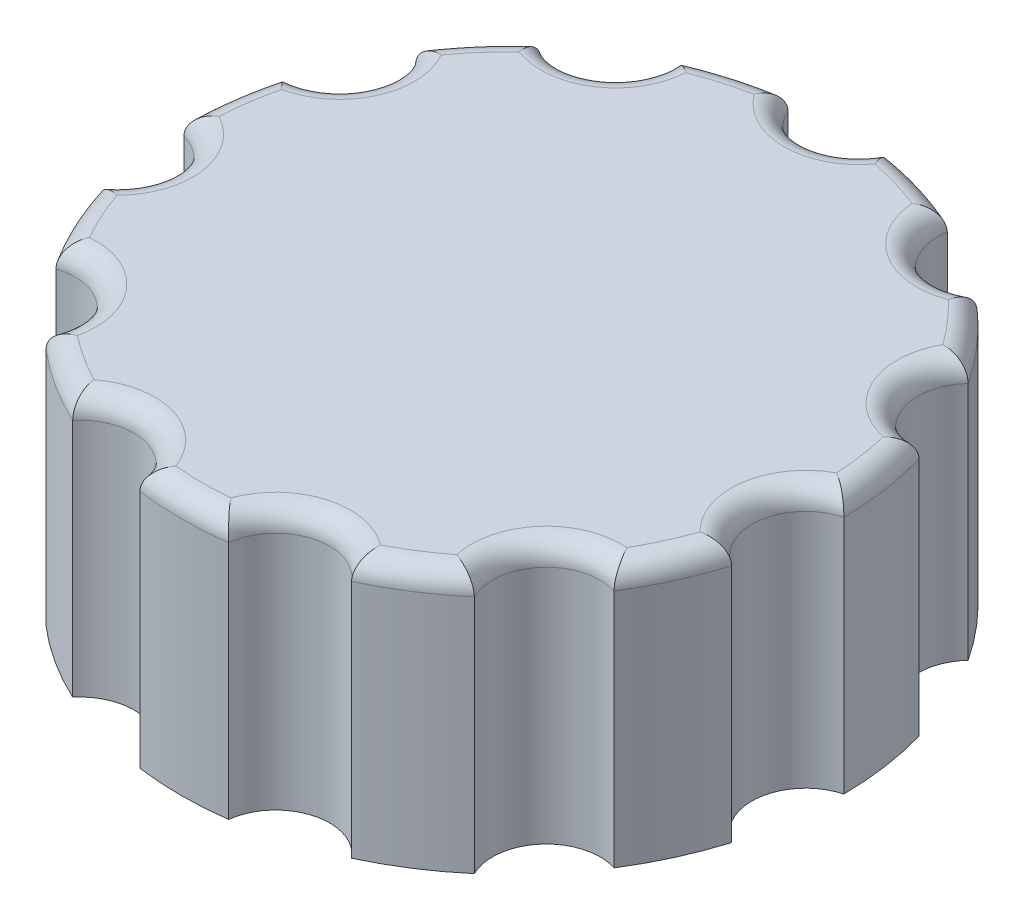
from build123d import *

# Parameters (mm, degrees)
SKETCH1_R           = 2.85
BOSS_EXTRUDE1_DEPTH = 6.5
BOSS_EXTRUDE2_START = 1
BOSS_EXTRUDE2_DEPTH = 1
FILLET1_R           = 0.6


with BuildPart() as part:
    # Sketch1 → Boss-Extrude1 (new body)
    with BuildSketch(Plane(origin=(0, 0, 0), x_dir=(1, 0, 0), z_dir=(0, 1, 0))):
        with BuildLine():
            ThreePointArc((9.093842395, -2.748095796), (8.363991184, -1.202560383), (9.499705936, 0.074747137))
            ThreePointArc((9.499705936, 0.074747137), (9.403303698, 1.351990964), (9.135959799, 2.604657089))
            ThreePointArc((9.135959799, 2.604657089), (7.686390361, 3.51025686), (7.951249826, 5.198810076))
            ThreePointArc((7.951249826, 5.198810076), (7.179620956, 6.221176972), (6.277474519, 7.130449752))
            ThreePointArc((6.277474519, 7.130449752), (4.568414907, 7.108592352), (3.878328077, 8.672287549))
            ThreePointArc((3.878328077, 8.672287549), (2.67645929, 9.115183249), (1.425935433, 9.392375))
            ThreePointArc((1.425935433, 9.392375), (0, 8.45), (-1.425935433, 9.392375))
            ThreePointArc((-1.425935433, 9.392375), (-2.67645929, 9.115183249), (-3.878328077, 8.672287549))
            ThreePointArc((-3.878328077, 8.672287549), (-3.861897872, 8.542873061), (-3.856408175, 8.412535328))
            ThreePointArc((-3.856408175, 8.412535328), (-4.68102994, 7.042744681), (-6.277474519, 7.130449752))
            ThreePointArc((-6.277474519, 7.130449752), (-7.179620956, 6.221176972), (-7.951249826, 5.198810076))
            ThreePointArc((-7.951249826, 5.198810076), (-7.651093553, 4.714347105), (-7.546319954, 4.15415013))
            ThreePointArc((-7.546319954, 4.15415013), (-8.014410013, 3.044208294), (-9.135959799, 2.604657089))
            ThreePointArc((-9.135959799, 2.604657089), (-9.403303698, 1.351990964), (-9.499705936, 0.074747137))
            ThreePointArc((-9.499705936, 0.074747137), (-8.669355568, -0.478475992), (-8.348214419, -1.423148383))
            ThreePointArc((-8.348214419, -1.423148383), (-8.547422681, -2.183320522), (-9.093842395, -2.748095796))
            ThreePointArc((-9.093842395, -2.748095796), (-8.641503956, -3.946442624), (-8.032072533, -5.073047489))
            ThreePointArc((-8.032072533, -5.073047489), (-6.644559279, -5.295991272), (-6.007495744, -6.548607339))
            ThreePointArc((-6.007495744, -6.548607339), (-6.047255322, -6.897425156), (-6.164494284, -7.228347683))
            ThreePointArc((-6.164494284, -7.228347683), (-5.136087766, -7.991908562), (-4.014312852, -8.610185383))
            ThreePointArc((-4.014312852, -8.610185383), (-2.380640105, -8.107715627), (-1.277962795, -9.413650254))
            ThreePointArc((-1.277962795, -9.413650254), (0, -9.5), (1.277962795, -9.413650254))
            ThreePointArc((1.277962795, -9.413650254), (2.380640105, -8.107715627), (4.014312852, -8.610185383))
            ThreePointArc((4.014312852, -8.610185383), (5.136087766, -7.991908562), (6.164494284, -7.228347683))
            ThreePointArc((6.164494284, -7.228347683), (6.386083903, -5.533573202), (8.032072533, -5.073047489))
            ThreePointArc((8.032072533, -5.073047489), (8.641503956, -3.946442624), (9.093842395, -2.748095796))
        make_face()
        Circle(SKETCH1_R, mode=Mode.SUBTRACT)
    extrude(amount=-BOSS_EXTRUDE1_DEPTH)

    # Sketch1<2> → Boss-Extrude2 (add)
    with BuildSketch(Plane(origin=(0, 0, 0), x_dir=(1, 0, 0), z_dir=(0, 1, 0)).offset(BOSS_EXTRUDE2_START)):
        with BuildLine():
            ThreePointArc((9.093842395, -2.748095796), (8.363991184, -1.202560383), (9.499705936, 0.074747137))
            ThreePointArc((9.499705936, 0.074747137), (9.403303698, 1.351990964), (9.135959799, 2.604657089))
            ThreePointArc((9.135959799, 2.604657089), (7.686390361, 3.51025686), (7.951249826, 5.198810076))
            ThreePointArc((7.951249826, 5.198810076), (7.179620956, 6.221176972), (6.277474519, 7.130449752))
            ThreePointArc((6.277474519, 7.130449752), (4.568414907, 7.108592352), (3.878328077, 8.672287549))
            ThreePointArc((3.878328077, 8.672287549), (2.67645929, 9.115183249), (1.425935433, 9.392375))
            ThreePointArc((1.425935433, 9.392375), (0, 8.45), (-1.425935433, 9.392375))
            ThreePointArc((-1.425935433, 9.392375), (-2.67645929, 9.115183249), (-3.878328077, 8.672287549))
            ThreePointArc((-3.878328077, 8.672287549), (-4.568414907, 7.108592352), (-6.277474519, 7.130449752))
            ThreePointArc((-6.277474519, 7.130449752), (-7.179620956, 6.221176972), (-7.951249826, 5.198810076))
            ThreePointArc((-7.951249826, 5.198810076), (-7.686390361, 3.51025686), (-9.135959799, 2.604657089))
            ThreePointArc((-9.135959799, 2.604657089), (-9.403303698, 1.351990964), (-9.499705936, 0.074747137))
            ThreePointArc((-9.499705936, 0.074747137), (-8.363991184, -1.202560383), (-9.093842395, -2.748095796))
            ThreePointArc((-9.093842395, -2.748095796), (-8.641503956, -3.946442624), (-8.032072533, -5.073047489))
            ThreePointArc((-8.032072533, -5.073047489), (-6.386083903, -5.533573202), (-6.164494284, -7.228347683))
            ThreePointArc((-6.164494284, -7.228347683), (-5.136087766, -7.991908562), (-4.014312852, -8.610185383))
            ThreePointArc((-4.014312852, -8.610185383), (-2.380640105, -8.107715627), (-1.277962795, -9.413650254))
            ThreePointArc((-1.277962795, -9.413650254), (0, -9.5), (1.277962795, -9.413650254))
            ThreePointArc((1.277962795, -9.413650254), (2.380640105, -8.107715627), (4.014312852, -8.610185383))
            ThreePointArc((4.014312852, -8.610185383), (5.136087766, -7.991908562), (6.164494284, -7.228347683))
            ThreePointArc((6.164494284, -7.228347683), (6.386083903, -5.533573202), (8.032072533, -5.073047489))
            ThreePointArc((8.032072533, -5.073047489), (8.641503956, -3.946442624), (9.093842395, -2.748095796))
        make_face()
    extrude(amount=-BOSS_EXTRUDE2_DEPTH)

    # Fillet1
    fillet1_edges = [part.edges().sort_by_distance(p)[0] for p in [
        (-2.67645929, 1, -9.115183249),
        (0, 1, -8.45),
        (2.67645929, 1, -9.115183249),
        (4.568414907, 1, -7.108592352),
        (7.179620956, 1, -6.221176972),
        (7.686390361, 1, -3.51025686),
        (9.403303698, 1, -1.351990964),
        (8.363991184, 1, 1.202560383),
        (8.641503956, 1, 3.946442624),
        (6.386083903, 1, 5.533573202),
        (5.136087766, 1, 7.991908562),
        (2.380640105, 1, 8.107715627),
        (0, 1, 9.5),
        (-2.380640105, 1, 8.107715627),
        (-5.136087766, 1, 7.991908562),
        (-6.386083903, 1, 5.533573202),
        (-8.641503956, 1, 3.946442624),
        (-8.363991184, 1, 1.202560383),
        (-9.403303698, 1, -1.351990964),
        (-7.686390361, 1, -3.51025686),
        (-7.179620956, 1, -6.221176972),
        (-4.568414907, 1, -7.108592352),
    ]]
    fillet(fillet1_edges, radius=FILLET1_R)


solid = part.part
